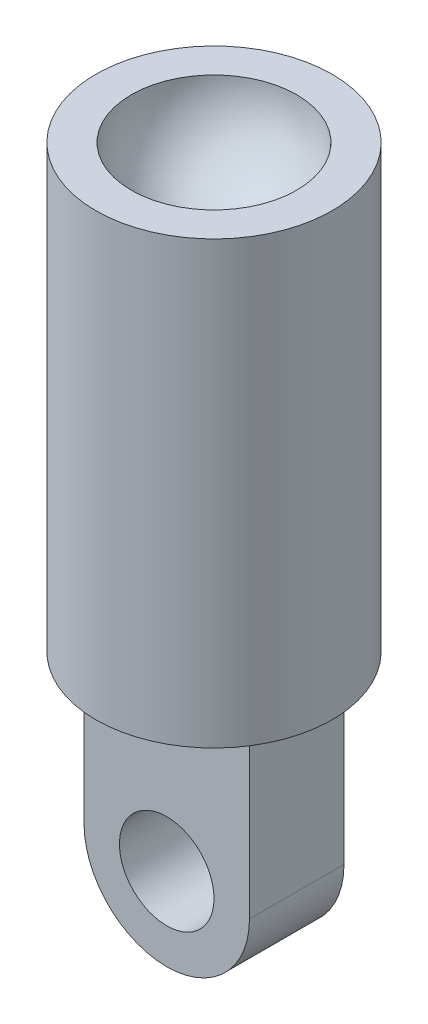
from build123d import *

# Parameters (mm, degrees)
SKETCH2_R           = 4
BOSS_EXTRUDE1_DEPTH = 4
FILLET1_R           = 1


with BuildPart() as part:
    # Sketch1 → Revolve1 (revolve)
    with BuildSketch(Plane.XY):
        with BuildLine():
            ThreePointArc((0, -7), (-4.949747468, -4.949747468), (-7, 0))
            Line((-7, 0), (-10, 0))
            Line((-10, 0), (-10, -37.303915827))
            Line((-10, -37.303915827), (0, -37.303915827))
            Line((0, -37.303915827), (0, -7))
        make_face()
    revolve(axis=Axis((0, 4.024665624, 0), (0, -1, 0)))

    # Sketch2 → Boss-Extrude1 (add, symmetric)
    with BuildSketch(Plane.XY):
        with BuildLine():
            Line((-7, -51.4), (-7, -37.303915827))
            Line((-7, -37.303915827), (7, -37.303915827))
            Line((7, -37.303915827), (7, -51.4))
            ThreePointArc((7, -51.4), (0, -58.4), (-7, -51.4))
        make_face()
        with Locations((0, -51.4)):
            Circle(SKETCH2_R, mode=Mode.SUBTRACT)
    extrude(amount=BOSS_EXTRUDE1_DEPTH, both=True)

    # Fillet1
    fillet1_edges = [part.edges().sort_by_distance(p)[0] for p in [
        (0, -37.303915827, 4),
        (0, -37.303915827, -4),
        (7, -37.303915827, 0),
        (-7, -37.303915827, 0),
    ]]
    fillet(fillet1_edges, radius=FILLET1_R)


solid = part.part
